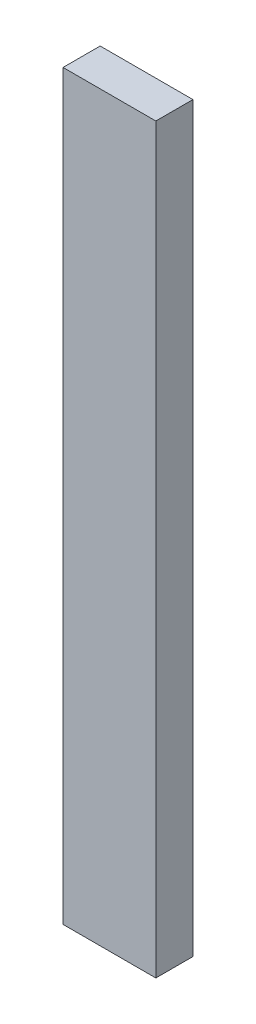
from build123d import *

# Parameters (mm, degrees)
SKETCH_1_W      = 25
SKETCH_1_H      = 10
EXTRUDE_1_DEPTH = 200


with BuildPart() as part:
    # 草图1 → 凸台-拉伸1 (new body)
    with BuildSketch(Plane(origin=(0, 0, 0), x_dir=(1, 0, 0), z_dir=(0, 1, 0))):
        with Locations((12.5, 5)):
            Rectangle(SKETCH_1_W, SKETCH_1_H)
    extrude(amount=EXTRUDE_1_DEPTH)


solid = part.part
